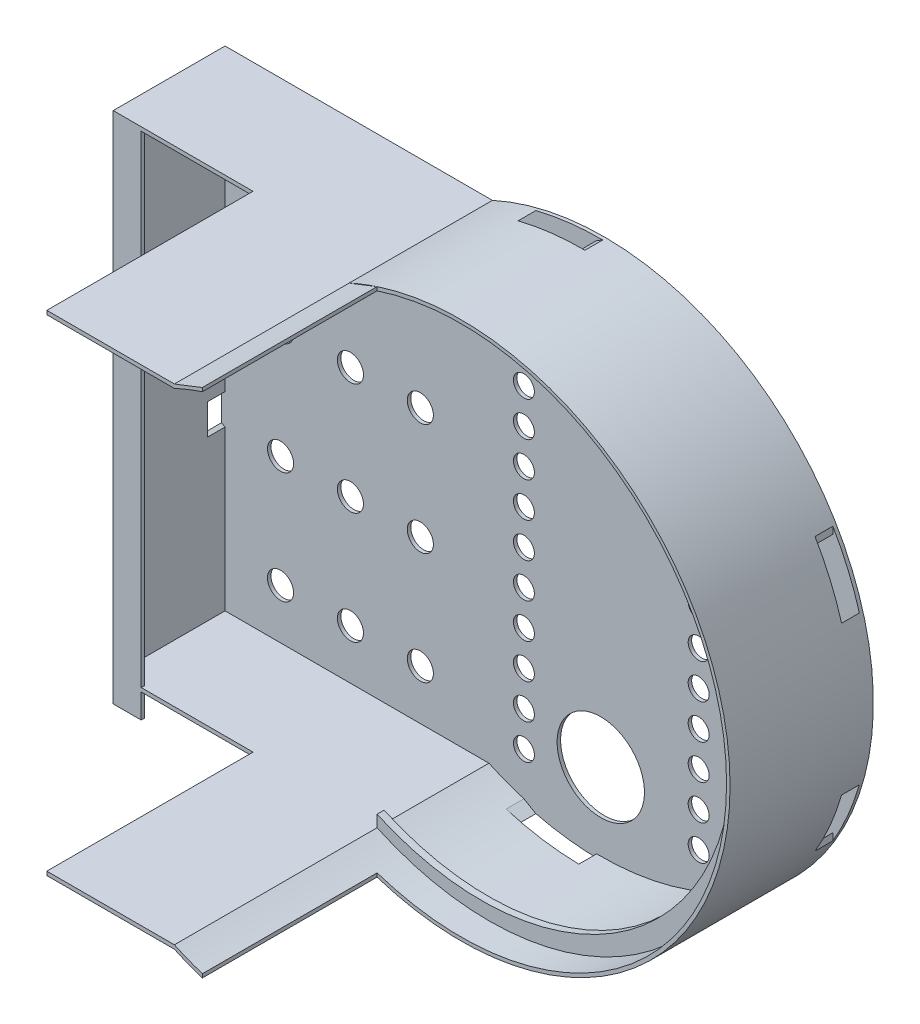
from build123d import *

# Parameters (mm, degrees)
SKETCH1_R                  = 77
BOSS_EXTRUDE1_DEPTH        = 10
SKETCH2_R                  = 76
CUT_EXTRUDE1_DEPTH         = 8
SKETCH3_R                  = 77
SKETCH3_R_2                = 76
BOSS_EXTRUDE2_DEPTH        = 30
SKETCH4_R                  = 77
BOSS_EXTRUDE3_DEPTH        = 1
SKETCH5_W                  = 45
SKETCH5_H                  = 163.805350841
CUT_EXTRUDE3_DEPTH         = 117.357208629
BOSS_EXTRUDE4_DEPTH        = 36.5
SKETCH9_R                  = 12.5
CUT_EXTRUDE4_DEPTH         = 114.784884761
CIRPATTERN1_COUNT          = 3
CIRPATTERN1_ANGLE          = 180
BOSS_EXTRUDE5_START        = 50
BOSS_EXTRUDE5_DEPTH        = 50
BOSS_EXTRUDE6_DEPTH        = 40
BOSS_EXTRUDE8_REACH        = 193.492
SKETCH12_W                 = 1
SKETCH12_H                 = 31
CUT_EXTRUDE6_REACH         = 147.139
SKETCH13_R                 = 27.198384407
CUT_EXTRUDE7_REACH         = 162.628
SKETCH14_R                 = 3
LPATTERN1_COUNT            = 13
LPATTERN1_PITCH            = 10
LPATTERN5_COUNT            = 2
LPATTERN5_PITCH            = 50
LPATTERN5_COPY_1_REACH     = 162.628
LPATTERN5_COPY_1_SKETCH_R  = 3
LPATTERN5_COPY_2_REACH     = 162.628
LPATTERN5_COPY_2_SKETCH_R  = 3
LPATTERN5_COPY_3_REACH     = 162.628
LPATTERN5_COPY_3_SKETCH_R  = 3
LPATTERN5_COPY_4_REACH     = 162.628
LPATTERN5_COPY_4_SKETCH_R  = 3
LPATTERN5_COPY_5_REACH     = 162.628
LPATTERN5_COPY_5_SKETCH_R  = 3
LPATTERN5_COPY_6_REACH     = 162.628
LPATTERN5_COPY_6_SKETCH_R  = 3
LPATTERN5_COPY_7_REACH     = 162.628
LPATTERN5_COPY_7_SKETCH_R  = 3
LPATTERN5_COPY_8_REACH     = 162.628
LPATTERN5_COPY_8_SKETCH_R  = 3
LPATTERN5_COPY_9_REACH     = 162.628
LPATTERN5_COPY_9_SKETCH_R  = 3
LPATTERN5_COPY_10_REACH    = 162.628
LPATTERN5_COPY_10_SKETCH_R = 3
LPATTERN5_COPY_11_REACH    = 162.628
LPATTERN5_COPY_11_SKETCH_R = 3
LPATTERN5_COPY_12_REACH    = 162.628
LPATTERN5_COPY_12_SKETCH_R = 3
SKETCH15_W                 = 1
SKETCH15_H                 = 1.100953422
BOSS_EXTRUDE9_DEPTH        = 40
CUT_EXTRUDE8_DEPTH         = 10
SKETCH17_W                 = 7.6001612
SKETCH17_H                 = 5.091357209
CUT_EXTRUDE9_DEPTH         = 146.94947756
CIRPATTERN2_COUNT          = 3
SKETCH19_W                 = 8
SKETCH19_H                 = 1
BOSS_EXTRUDE10_DEPTH       = 145.934752
SKETCH20_R                 = 3.734224409
CUT_EXTRUDE10_DEPTH        = 161.627675191
LPATTERN6_COUNT            = 3
LPATTERN6_PITCH            = 20
LPATTERN7_COUNT            = 3
LPATTERN7_PITCH            = 32
LPATTERN7_COPY_1_SKETCH_R  = 3.734224409
LPATTERN7_COPY_1_DEPTH     = 161.627675191
LPATTERN7_COPY_2_SKETCH_R  = 3.734224409
LPATTERN7_COPY_2_DEPTH     = 161.627675191
LPATTERN7_COPY_3_SKETCH_R  = 3.734224409
LPATTERN7_COPY_3_DEPTH     = 161.627675191
LPATTERN7_COPY_4_SKETCH_R  = 3.734224409
LPATTERN7_COPY_4_DEPTH     = 161.627675191


with BuildPart() as part:
    # Sketch1 → Boss-Extrude1 (new body)
    with BuildSketch(Plane.XY):
        Circle(SKETCH1_R)
    extrude(amount=BOSS_EXTRUDE1_DEPTH)

    # Sketch2 → Cut-Extrude1 (cut)
    with BuildSketch(Plane.XY.offset(10)):
        Circle(SKETCH2_R)
    extrude(amount=-CUT_EXTRUDE1_DEPTH, mode=Mode.SUBTRACT)

    # Sketch3 → Boss-Extrude2 (add)
    with BuildSketch(Plane(origin=(0, 0, 0), x_dir=(-1, 0, 0), z_dir=(0, 0, -1))):
        Circle(SKETCH3_R)
        with Locations(Location((0, 0, 0), (0, 0, 180))):
            Circle(SKETCH3_R_2, mode=Mode.SUBTRACT)
    extrude(amount=BOSS_EXTRUDE2_DEPTH)

    # Sketch4 → Boss-Extrude3 (add)
    with BuildSketch(Plane(origin=(0, 0, -30), x_dir=(-1, 0, 0), z_dir=(0, 0, -1))):
        Circle(SKETCH4_R)
    extrude(amount=BOSS_EXTRUDE3_DEPTH)

    # Sketch5 → Cut-Extrude3 (cut, through all)
    with BuildSketch(Plane(origin=(0, 0, -31), x_dir=(-1, 0, 0), z_dir=(0, 0, -1))):
        with Locations((54.5, 2.738783732)):
            Rectangle(SKETCH5_W, SKETCH5_H)
    extrude(amount=-CUT_EXTRUDE3_DEPTH, mode=Mode.SUBTRACT)

    # Sketch8 → Boss-Extrude4 (add)
    with BuildSketch(Plane.ZY.offset(32)):
        Polygon((2, 70.03570518), (-31, 70.03570518), (-31, -70.03570518), (2, -70.03570518), (10, -70.03570518), (10, -68.934751758), (2, -68.934751758), (-30, -68.934751758), (-30, 68.934751758), (2, 68.934751758), (10, 68.934751758), (10, 70.03570518), align=None)
    extrude(amount=BOSS_EXTRUDE4_DEPTH)

    # Sketch9 → Cut-Extrude4 (cut, through all)
    with BuildSketch(Plane.XY.offset(2)):
        with Locations((0, 53.923821134)):
            Circle(SKETCH9_R)
    cut_extrude4 = extrude(amount=-CUT_EXTRUDE4_DEPTH, mode=Mode.SUBTRACT)

    # CirPattern1: Cut-Extrude4 ×3 about axis
    cirpattern1_axis = Axis((0, 0, 0), (0, 0, -1))
    for i in range(1, CIRPATTERN1_COUNT):
        add(cut_extrude4.rotate(cirpattern1_axis, i * CIRPATTERN1_ANGLE / (CIRPATTERN1_COUNT - 1)), mode=Mode.SUBTRACT)

    # Sketch10 → Boss-Extrude5 (add)
    with BuildSketch(Plane.XY.offset(10).offset(BOSS_EXTRUDE5_START)):
        with BuildLine():
            Line((-68.5, 70.03570518), (-68.5, 68.934751758))
            Line((-68.5, 68.934751758), (-32, 68.934751758))
            ThreePointArc((-32, 68.934751758), (-28.045172196, 70.636168614), (-24.000345987, 72.110910357))
            Line((-24.000345987, 72.110910357), (-24.000345987, 73.164085401))
            ThreePointArc((-24.000345987, 73.164085401), (-27.993317806, 71.58236573), (-32, 70.03570518))
            Line((-32, 70.03570518), (-68.5, 70.03570518))
        make_face()
        with BuildLine():
            Line((-68.5, -68.934751758), (-68.5, -70.03570518))
            Line((-68.5, -70.03570518), (-32, -70.03570518))
            ThreePointArc((-32, -70.03570518), (-28.043829595, -71.711530605), (-24.000345987, -73.164085401))
            Line((-24.000345987, -73.164085401), (-24.000345987, -72.110910357))
            ThreePointArc((-24.000345987, -72.110910357), (-28.045172196, -70.636168614), (-32, -68.934751758))
            Line((-32, -68.934751758), (-68.5, -68.934751758))
        make_face()
    extrude(amount=-BOSS_EXTRUDE5_DEPTH)

    # Sketch11 → Boss-Extrude6 (add)
    with BuildSketch(Plane.ZY.offset(68.5)):
        Polygon((0, 68.934751758), (0, 70.03570518), (-31, 70.03570518), (-31, -70.03570518), (0, -70.03570518), (0, -68.934751758), (-30, -68.934751758), (-30, 68.934751758), align=None)
    extrude(amount=BOSS_EXTRUDE6_DEPTH)

    # Sketch12 → Boss-Extrude8 (add, up to next)
    with BuildSketch(Plane.XZ.offset(-68.934751758), mode=Mode.PRIVATE) as boss_extrude8_sk1:
        with Locations((-108, -15.5)):
            Rectangle(SKETCH12_W, SKETCH12_H)
    boss_extrude8_tool1 = extrude(boss_extrude8_sk1.sketch, amount=BOSS_EXTRUDE8_REACH, mode=Mode.PRIVATE) - part.part
    add(boss_extrude8_tool1.solids().sort_by_distance((-108, 68.934752, -15.5))[0])

    # Sketch13 → Cut-Extrude6 (cut, up to next)
    with BuildSketch(Plane.XY.offset(2), mode=Mode.PRIVATE) as cut_extrude6_sk1:
        Circle(SKETCH13_R)
    cut_extrude6_tool1 = extrude(cut_extrude6_sk1.sketch, amount=-CUT_EXTRUDE6_REACH, mode=Mode.PRIVATE) & part.part
    add(cut_extrude6_tool1.solids().sort_by_distance((0, 0, 2))[0], mode=Mode.SUBTRACT)

    # Sketch14 → Cut-Extrude7 (cut, up to next)
    with BuildSketch(Plane.XY.offset(-30), mode=Mode.PRIVATE) as cut_extrude7_sk1:
        with Locations((-21.991326119, 59.568640729)):
            Circle(SKETCH14_R)
    cut_extrude7_tool1 = extrude(cut_extrude7_sk1.sketch, amount=-CUT_EXTRUDE7_REACH, mode=Mode.PRIVATE) & part.part
    cut_extrude7 = cut_extrude7_tool1.solids().sort_by_distance((-21.991326, 59.568641, -30))[0]
    add(cut_extrude7, mode=Mode.SUBTRACT)

    # LPattern1: Cut-Extrude7 ×13
    with Locations(*[(0, -i * LPATTERN1_PITCH, 0) for i in range(1, LPATTERN1_COUNT)]):
        add(cut_extrude7, mode=Mode.SUBTRACT)

    # LPattern5: Cut-Extrude7 ×2
    with Locations(*[(i * LPATTERN5_PITCH, 0, 0) for i in range(1, LPATTERN5_COUNT)]):
        add(cut_extrude7, mode=Mode.SUBTRACT)

    # LPattern5 copy 1 sketch → LPattern5 copy 1 (cut, up to next)
    with BuildSketch(Plane(origin=(50, -10, -30), x_dir=(1, 0, 0), z_dir=(0, 0, 1)), mode=Mode.PRIVATE) as lpattern5_copy_1_sk1:
        with Locations((-21.991326119, 59.568640729)):
            Circle(LPATTERN5_COPY_1_SKETCH_R)
    lpattern5_copy_1_tool1 = extrude(lpattern5_copy_1_sk1.sketch, amount=-LPATTERN5_COPY_1_REACH, mode=Mode.PRIVATE) & part.part
    add(lpattern5_copy_1_tool1.solids().sort_by_distance((28.008674, 49.568641, -30))[0], mode=Mode.SUBTRACT)

    # LPattern5 copy 2 sketch → LPattern5 copy 2 (cut, up to next)
    with BuildSketch(Plane(origin=(50, -20, -30), x_dir=(1, 0, 0), z_dir=(0, 0, 1)), mode=Mode.PRIVATE) as lpattern5_copy_2_sk1:
        with Locations((-21.991326119, 59.568640729)):
            Circle(LPATTERN5_COPY_2_SKETCH_R)
    lpattern5_copy_2_tool1 = extrude(lpattern5_copy_2_sk1.sketch, amount=-LPATTERN5_COPY_2_REACH, mode=Mode.PRIVATE) & part.part
    add(lpattern5_copy_2_tool1.solids().sort_by_distance((28.008674, 39.568641, -30))[0], mode=Mode.SUBTRACT)

    # LPattern5 copy 3 sketch → LPattern5 copy 3 (cut, up to next)
    with BuildSketch(Plane(origin=(50, -30, -30), x_dir=(1, 0, 0), z_dir=(0, 0, 1)), mode=Mode.PRIVATE) as lpattern5_copy_3_sk1:
        with Locations((-21.991326119, 59.568640729)):
            Circle(LPATTERN5_COPY_3_SKETCH_R)
    lpattern5_copy_3_tool1 = extrude(lpattern5_copy_3_sk1.sketch, amount=-LPATTERN5_COPY_3_REACH, mode=Mode.PRIVATE) & part.part
    add(lpattern5_copy_3_tool1.solids().sort_by_distance((28.008674, 29.568641, -30))[0], mode=Mode.SUBTRACT)

    # LPattern5 copy 4 sketch → LPattern5 copy 4 (cut, up to next)
    with BuildSketch(Plane(origin=(50, -40, -30), x_dir=(1, 0, 0), z_dir=(0, 0, 1)), mode=Mode.PRIVATE) as lpattern5_copy_4_sk1:
        with Locations((-21.991326119, 59.568640729)):
            Circle(LPATTERN5_COPY_4_SKETCH_R)
    lpattern5_copy_4_tool1 = extrude(lpattern5_copy_4_sk1.sketch, amount=-LPATTERN5_COPY_4_REACH, mode=Mode.PRIVATE) & part.part
    add(lpattern5_copy_4_tool1.solids().sort_by_distance((28.008674, 19.568641, -30))[0], mode=Mode.SUBTRACT)

    # LPattern5 copy 5 sketch → LPattern5 copy 5 (cut, up to next)
    with BuildSketch(Plane(origin=(50, -50, -30), x_dir=(1, 0, 0), z_dir=(0, 0, 1)), mode=Mode.PRIVATE) as lpattern5_copy_5_sk1:
        with Locations((-21.991326119, 59.568640729)):
            Circle(LPATTERN5_COPY_5_SKETCH_R)
    lpattern5_copy_5_tool1 = extrude(lpattern5_copy_5_sk1.sketch, amount=-LPATTERN5_COPY_5_REACH, mode=Mode.PRIVATE) & part.part
    add(lpattern5_copy_5_tool1.solids().sort_by_distance((28.008674, 9.568641, -30))[0], mode=Mode.SUBTRACT)

    # LPattern5 copy 6 sketch → LPattern5 copy 6 (cut, up to next)
    with BuildSketch(Plane(origin=(50, -60, -30), x_dir=(1, 0, 0), z_dir=(0, 0, 1)), mode=Mode.PRIVATE) as lpattern5_copy_6_sk1:
        with Locations((-21.991326119, 59.568640729)):
            Circle(LPATTERN5_COPY_6_SKETCH_R)
    lpattern5_copy_6_tool1 = extrude(lpattern5_copy_6_sk1.sketch, amount=-LPATTERN5_COPY_6_REACH, mode=Mode.PRIVATE) & part.part
    add(lpattern5_copy_6_tool1.solids().sort_by_distance((28.008674, -0.431359, -30))[0], mode=Mode.SUBTRACT)

    # LPattern5 copy 7 sketch → LPattern5 copy 7 (cut, up to next)
    with BuildSketch(Plane(origin=(50, -70, -30), x_dir=(1, 0, 0), z_dir=(0, 0, 1)), mode=Mode.PRIVATE) as lpattern5_copy_7_sk1:
        with Locations((-21.991326119, 59.568640729)):
            Circle(LPATTERN5_COPY_7_SKETCH_R)
    lpattern5_copy_7_tool1 = extrude(lpattern5_copy_7_sk1.sketch, amount=-LPATTERN5_COPY_7_REACH, mode=Mode.PRIVATE) & part.part
    add(lpattern5_copy_7_tool1.solids().sort_by_distance((28.008674, -10.431359, -30))[0], mode=Mode.SUBTRACT)

    # LPattern5 copy 8 sketch → LPattern5 copy 8 (cut, up to next)
    with BuildSketch(Plane(origin=(50, -80, -30), x_dir=(1, 0, 0), z_dir=(0, 0, 1)), mode=Mode.PRIVATE) as lpattern5_copy_8_sk1:
        with Locations((-21.991326119, 59.568640729)):
            Circle(LPATTERN5_COPY_8_SKETCH_R)
    lpattern5_copy_8_tool1 = extrude(lpattern5_copy_8_sk1.sketch, amount=-LPATTERN5_COPY_8_REACH, mode=Mode.PRIVATE) & part.part
    add(lpattern5_copy_8_tool1.solids().sort_by_distance((28.008674, -20.431359, -30))[0], mode=Mode.SUBTRACT)

    # LPattern5 copy 9 sketch → LPattern5 copy 9 (cut, up to next)
    with BuildSketch(Plane(origin=(50, -90, -30), x_dir=(1, 0, 0), z_dir=(0, 0, 1)), mode=Mode.PRIVATE) as lpattern5_copy_9_sk1:
        with Locations((-21.991326119, 59.568640729)):
            Circle(LPATTERN5_COPY_9_SKETCH_R)
    lpattern5_copy_9_tool1 = extrude(lpattern5_copy_9_sk1.sketch, amount=-LPATTERN5_COPY_9_REACH, mode=Mode.PRIVATE) & part.part
    add(lpattern5_copy_9_tool1.solids().sort_by_distance((28.008674, -30.431359, -30))[0], mode=Mode.SUBTRACT)

    # LPattern5 copy 10 sketch → LPattern5 copy 10 (cut, up to next)
    with BuildSketch(Plane(origin=(50, -100, -30), x_dir=(1, 0, 0), z_dir=(0, 0, 1)), mode=Mode.PRIVATE) as lpattern5_copy_10_sk1:
        with Locations((-21.991326119, 59.568640729)):
            Circle(LPATTERN5_COPY_10_SKETCH_R)
    lpattern5_copy_10_tool1 = extrude(lpattern5_copy_10_sk1.sketch, amount=-LPATTERN5_COPY_10_REACH, mode=Mode.PRIVATE) & part.part
    add(lpattern5_copy_10_tool1.solids().sort_by_distance((28.008674, -40.431359, -30))[0], mode=Mode.SUBTRACT)

    # LPattern5 copy 11 sketch → LPattern5 copy 11 (cut, up to next)
    with BuildSketch(Plane(origin=(50, -110, -30), x_dir=(1, 0, 0), z_dir=(0, 0, 1)), mode=Mode.PRIVATE) as lpattern5_copy_11_sk1:
        with Locations((-21.991326119, 59.568640729)):
            Circle(LPATTERN5_COPY_11_SKETCH_R)
    lpattern5_copy_11_tool1 = extrude(lpattern5_copy_11_sk1.sketch, amount=-LPATTERN5_COPY_11_REACH, mode=Mode.PRIVATE) & part.part
    add(lpattern5_copy_11_tool1.solids().sort_by_distance((28.008674, -50.431359, -30))[0], mode=Mode.SUBTRACT)

    # LPattern5 copy 12 sketch → LPattern5 copy 12 (cut, up to next)
    with BuildSketch(Plane(origin=(50, -120, -30), x_dir=(1, 0, 0), z_dir=(0, 0, 1)), mode=Mode.PRIVATE) as lpattern5_copy_12_sk1:
        with Locations((-21.991326119, 59.568640729)):
            Circle(LPATTERN5_COPY_12_SKETCH_R)
    lpattern5_copy_12_tool1 = extrude(lpattern5_copy_12_sk1.sketch, amount=-LPATTERN5_COPY_12_REACH, mode=Mode.PRIVATE) & part.part
    add(lpattern5_copy_12_tool1.solids().sort_by_distance((28.008674, -60.431359, -30))[0], mode=Mode.SUBTRACT)

    # Sketch15 → Boss-Extrude9 (add)
    with BuildSketch(Plane.ZY.offset(68.5)):
        with Locations((0.5, -69.485228469)):
            Rectangle(SKETCH15_W, SKETCH15_H)
        with Locations((0.5, 69.485228469)):
            Rectangle(SKETCH15_W, SKETCH15_H)
    extrude(amount=BOSS_EXTRUDE9_DEPTH)

    # Sketch16 → Cut-Extrude8 (cut)
    with BuildSketch(Plane.XY.offset(2)):
        with BuildLine():
            Line((-32, 65.26130379), (-32, -65.574307646))
            ThreePointArc((-32, -65.574307646), (69.620577929, -0.156501928), (-32, 65.26130379))
        make_face()
    extrude(amount=-CUT_EXTRUDE8_DEPTH, mode=Mode.SUBTRACT)

    # Sketch17 → Cut-Extrude9 (cut, symmetric)
    with BuildSketch(Plane(origin=(0, 0, 0), x_dir=(1, 0, 0), z_dir=(0, 1, 0))):
        with Locations((70.1999194, 27.454321396)):
            Rectangle(SKETCH17_W, SKETCH17_H)
    cut_extrude9 = extrude(amount=CUT_EXTRUDE9_DEPTH, both=True, mode=Mode.SUBTRACT)

    # CirPattern2: Cut-Extrude9 ×3 about axis
    cirpattern2_axis = Axis((0, 0, 0), (0, 0, 1))
    for i in range(1, CIRPATTERN2_COUNT):
        add(cut_extrude9.rotate(cirpattern2_axis, i * 360 / CIRPATTERN2_COUNT), mode=Mode.SUBTRACT)

    # Sketch19 → Boss-Extrude10 (add)
    with BuildSketch(Plane.XZ.offset(-68.934751758)):
        with Locations((-104.5, 0.5)):
            Rectangle(SKETCH19_W, SKETCH19_H)
    extrude(amount=BOSS_EXTRUDE10_DEPTH)

    # Sketch20 → Cut-Extrude10 (cut, symmetric)
    with BuildSketch(Plane.XY.offset(-30)):
        with Locations((-91.628693582, 9.328529247)):
            Circle(SKETCH20_R)
    cut_extrude10 = extrude(amount=CUT_EXTRUDE10_DEPTH, both=True, mode=Mode.SUBTRACT)

    # LPattern6: Cut-Extrude10 ×3
    with Locations(*[(i * LPATTERN6_PITCH, 0, 0) for i in range(1, LPATTERN6_COUNT)]):
        add(cut_extrude10, mode=Mode.SUBTRACT)

    # LPattern7: Cut-Extrude10 ×3
    with Locations(*[(0, -i * LPATTERN7_PITCH, 0) for i in range(1, LPATTERN7_COUNT)]):
        add(cut_extrude10, mode=Mode.SUBTRACT)

    # LPattern7 copy 1 sketch → LPattern7 copy 1 (cut, symmetric)
    with BuildSketch(Plane(origin=(20, -32, -30), x_dir=(1, 0, 0), z_dir=(0, 0, 1))):
        with Locations((-91.628693582, 9.328529247)):
            Circle(LPATTERN7_COPY_1_SKETCH_R)
    extrude(amount=LPATTERN7_COPY_1_DEPTH, both=True, mode=Mode.SUBTRACT)

    # LPattern7 copy 2 sketch → LPattern7 copy 2 (cut, symmetric)
    with BuildSketch(Plane(origin=(20, -64, -30), x_dir=(1, 0, 0), z_dir=(0, 0, 1))):
        with Locations((-91.628693582, 9.328529247)):
            Circle(LPATTERN7_COPY_2_SKETCH_R)
    extrude(amount=LPATTERN7_COPY_2_DEPTH, both=True, mode=Mode.SUBTRACT)

    # LPattern7 copy 3 sketch → LPattern7 copy 3 (cut, symmetric)
    with BuildSketch(Plane(origin=(40, -32, -30), x_dir=(1, 0, 0), z_dir=(0, 0, 1))):
        with Locations((-91.628693582, 9.328529247)):
            Circle(LPATTERN7_COPY_3_SKETCH_R)
    extrude(amount=LPATTERN7_COPY_3_DEPTH, both=True, mode=Mode.SUBTRACT)

    # LPattern7 copy 4 sketch → LPattern7 copy 4 (cut, symmetric)
    with BuildSketch(Plane(origin=(40, -64, -30), x_dir=(1, 0, 0), z_dir=(0, 0, 1))):
        with Locations((-91.628693582, 9.328529247)):
            Circle(LPATTERN7_COPY_4_SKETCH_R)
    extrude(amount=LPATTERN7_COPY_4_DEPTH, both=True, mode=Mode.SUBTRACT)


solid = part.part
